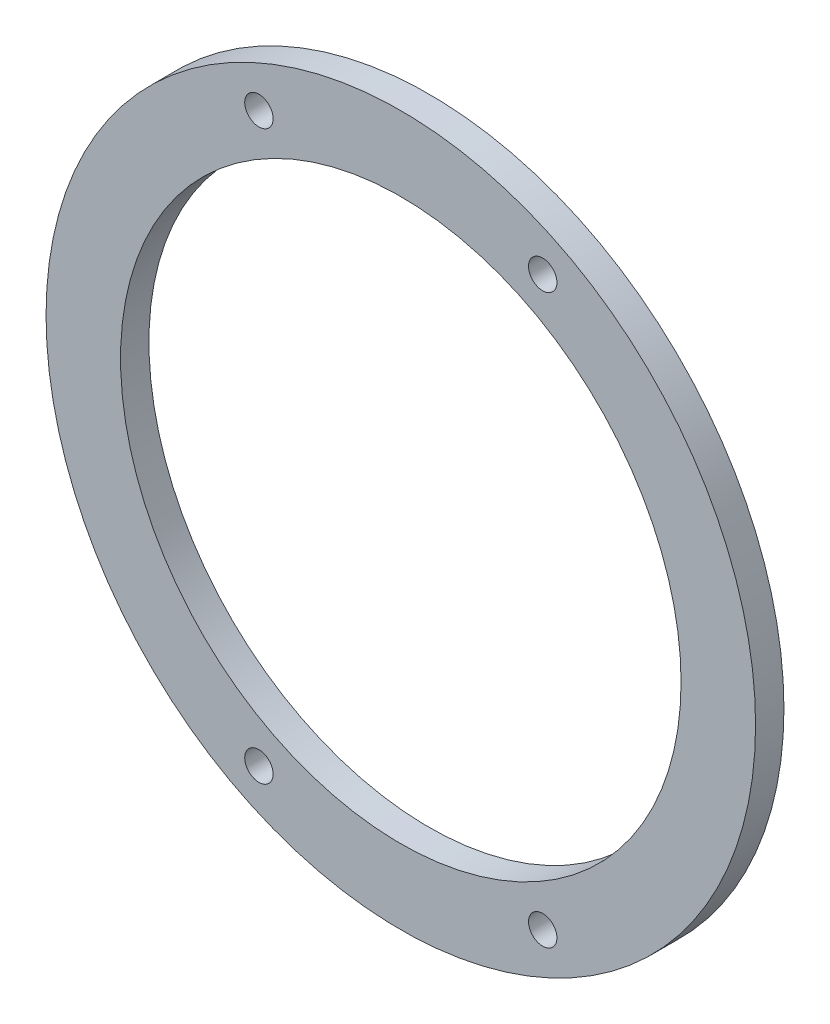
from build123d import *

# Parameters (mm, degrees)
SKETCH_1_R      = 50
SKETCH_1_R_2    = 2
SKETCH_1_R_3    = 39.5
EXTRUDE_1_DEPTH = 4


with BuildPart() as part:
    # 草图1 → 凸台-拉伸1 (new body)
    with BuildSketch(Plane.XY):
        with Locations((0, -21.854285714)):
            Circle(SKETCH_1_R)
        with Locations((-20, 18.145714286)):
            Circle(SKETCH_1_R_2, mode=Mode.SUBTRACT)
        with Locations((20, 18.145714286)):
            Circle(SKETCH_1_R_2, mode=Mode.SUBTRACT)
        with Locations(Location((20, -61.854285714, 0), (0, 0, 180))):
            Circle(SKETCH_1_R_2, mode=Mode.SUBTRACT)
        with Locations(Location((-20, -61.854285714, 0), (0, 0, 180))):
            Circle(SKETCH_1_R_2, mode=Mode.SUBTRACT)
        with Locations((0, -21.854285714)):
            Circle(SKETCH_1_R_3, mode=Mode.SUBTRACT)
    extrude(amount=EXTRUDE_1_DEPTH)


solid = part.part
